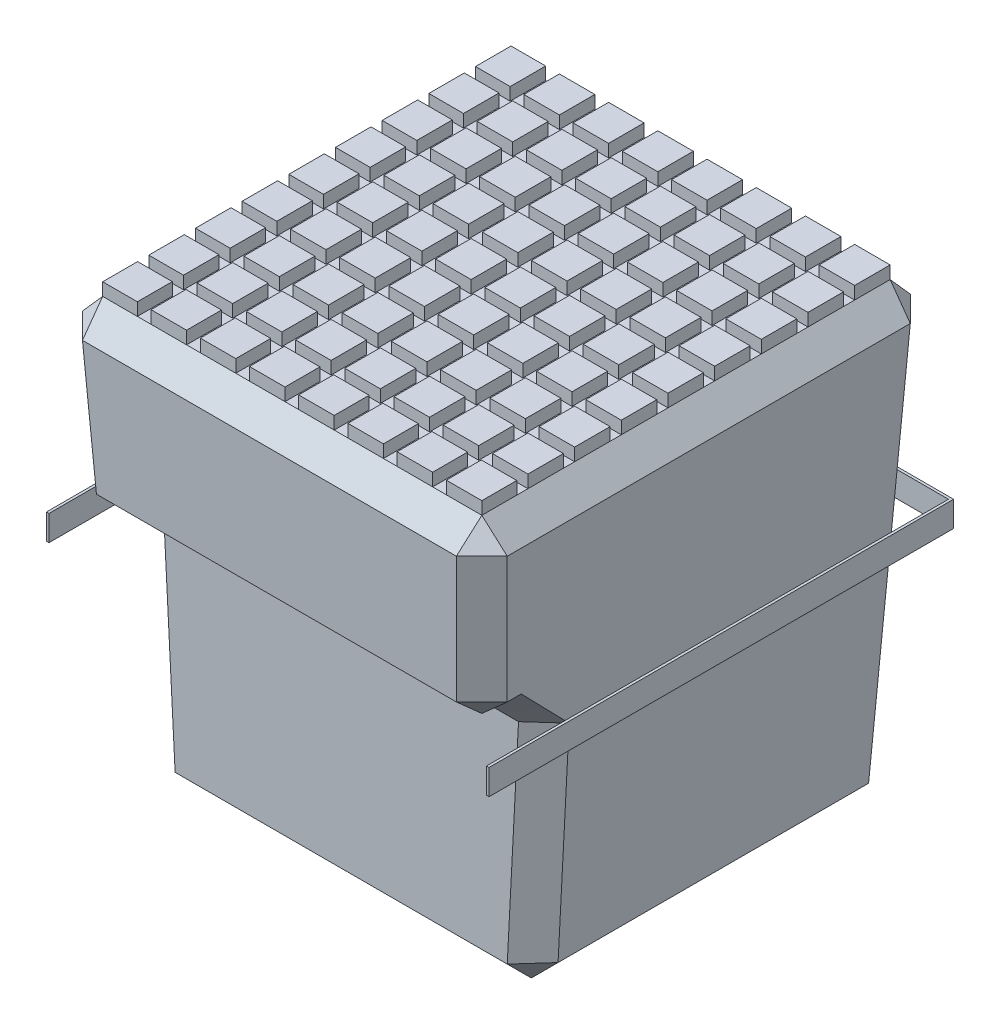
from build123d import *
from OCP.BRepFilletAPI import BRepFilletAPI_MakeChamfer

# Parameters (mm, degrees)
SKETCH2_W                = 337
SKETCH2_H                = 360
BOSS_EXTRUDE1_DEPTH      = 355
BOSS_EXTRUDE1_DRAFT      = -3
CUT_EXTRUDE1_DEPTH       = 433.223611109
CUT_EXTRUDE1_DEPTH_BACK  = 433.223611109
CHAMFER1_SIZE            = 20
CHAMFER1_SIZE2           = 21.135090055
CHAMFER1_SIZE2_2         = 20.055006944
CHAMFER1_SIZE2_3         = 19.030120562
SKETCH5_W                = 27.339758876
SKETCH5_H                = 28
SKETCH5_W_2              = 28
SKETCH5_H_2              = 27.539758876
BOSS_EXTRUDE2_DEPTH      = 10
BOSS_EXTRUDE3_DEPTH      = 10
BOSS_EXTRUDE3_DEPTH_BACK = 10


with BuildPart() as part:
    # Sketch2 → Boss-Extrude1 (with draft: the straight prism first)
    with BuildSketch(Plane(origin=(0, 0, 0), x_dir=(1, 0, 0), z_dir=(0, 1, 0))):
        Rectangle(SKETCH2_W, SKETCH2_H)
    extrude(amount=-BOSS_EXTRUDE1_DEPTH)
    # Boss-Extrude1: the draft: its side faces are tilted about the plane it starts from
    boss_extrude1_sides = [part.faces().sort_by_distance(p)[0] for p in [
        (0, -177.5, -180),
        (-168.5, -177.5, 0),
        (0, -177.5, 180),
        (168.5, -177.5, 0),
    ]]
    draft(boss_extrude1_sides, Plane(origin=(0, 0, 0), x_dir=(1, 0, 0), z_dir=(0, 1, 0)), BOSS_EXTRUDE1_DRAFT)

    # Sketch4 → Cut-Extrude1 (cut, two sides: drawn at the far end of the back side and taken through both)
    with BuildSketch(Plane(origin=(0, 0, 0), x_dir=(0, 0, -1), z_dir=(1, 0, 0)).offset(-CUT_EXTRUDE1_DEPTH_BACK)):
        Polygon((-172.400872004, -145), (-122.400872004, -145), (-122.400872004, -355), (-170.697619177, -355), align=None)
    extrude(amount=CUT_EXTRUDE1_DEPTH + CUT_EXTRUDE1_DEPTH_BACK, mode=Mode.SUBTRACT)

    # Chamfer1: one chamfer whose edges measure the first distance from different faces: ONE call of the kernel's chamfer builder (chamfer() names one face for all edges)
    chamfer1_edges_1 = [part.edges().sort_by_distance(p)[0] for p in [
        (149.895238355, -355, -19.497183175),
        (0, -355, -161.395238355),
        (-149.895238355, -355, -19.497183175),
    ]]
    chamfer1_side_1 = [part.faces().sort_by_distance(p)[0] for p in [
        (0, -355, -19.497183175),
    ]]
    chamfer1_edges_2 = [part.edges().sort_by_distance(p)[0] for p in [
        (0, -355, 122.400872004),
        (-155.398055179, -250, 122.400872004),
        (155.398055179, -250, 122.400872004),
        (0, -145, 122.400872004),
    ]]
    chamfer1_edges_3 = [part.edges().sort_by_distance(p)[0] for p in [
        (-164.700436002, -72.5, 176.200436002),
    ]]
    chamfer1_side_3 = [part.faces().sort_by_distance(p)[0] for p in [
        (0, -71.942486014, 176.229654072),
    ]]
    chamfer1_edges_4 = [part.edges().sort_by_distance(p)[0] for p in [
        (164.700436002, -72.5, 176.200436002),
    ]]
    chamfer1_side_4 = [part.faces().sort_by_distance(p)[0] for p in [
        (159.679195898, -168.310968763, -12.093988454),
    ]]
    chamfer1_edges_5 = [part.edges().sort_by_distance(p)[0] for p in [
        (0, -145, 172.400872004),
    ]]
    chamfer1_side_5 = [part.faces().sort_by_distance(p)[0] for p in [
        (0, -71.942486014, 176.229654072),
    ]]
    chamfer1_edges_6 = [part.edges().sort_by_distance(p)[0] for p in [
        (-160.900872004, -145, 147.400872004),
    ]]
    chamfer1_side_6 = [part.faces().sort_by_distance(p)[0] for p in [
        (-159.679195898, -168.310968763, -12.093988454),
    ]]
    chamfer1_edges_7 = [part.edges().sort_by_distance(p)[0] for p in [
        (160.900872004, -145, 147.400872004),
    ]]
    chamfer1_side_7 = [part.faces().sort_by_distance(p)[0] for p in [
        (159.679195898, -168.310968763, -12.093988454),
    ]]
    chamfer1_edges_8 = [part.edges().sort_by_distance(p)[0] for p in [
        (0, 0, -180),
    ]]
    chamfer1_side_8 = [part.faces().sort_by_distance(p)[0] for p in [
        (0, -174.042719243, -170.878807584),
    ]]
    chamfer1_edges_9 = [part.edges().sort_by_distance(p)[0] for p in [
        (168.5, 0, 0),
    ]]
    chamfer1_side_9 = [part.faces().sort_by_distance(p)[0] for p in [
        (159.679195898, -168.310968763, -12.093988454),
    ]]
    chamfer1_edges_10 = [part.edges().sort_by_distance(p)[0] for p in [
        (0, 0, 180),
    ]]
    chamfer1_side_10 = [part.faces().sort_by_distance(p)[0] for p in [
        (0, -71.942486014, 176.229654072),
    ]]
    chamfer1_edges_11 = [part.edges().sort_by_distance(p)[0] for p in [
        (-168.5, 0, 0),
    ]]
    chamfer1_side_11 = [part.faces().sort_by_distance(p)[0] for p in [
        (-159.679195898, -168.310968763, -12.093988454),
    ]]
    chamfer1_edges_12 = [part.edges().sort_by_distance(p)[0] for p in [
        (-159.197619177, -177.5, -170.697619177),
    ]]
    chamfer1_side_12 = [part.faces().sort_by_distance(p)[0] for p in [
        (-159.679195898, -168.310968763, -12.093988454),
    ]]
    chamfer1_edges_13 = [part.edges().sort_by_distance(p)[0] for p in [
        (159.197619177, -177.5, -170.697619177),
    ]]
    chamfer1_side_13 = [part.faces().sort_by_distance(p)[0] for p in [
        (0, -174.042719243, -170.878807584),
    ]]
    chamfer1 = BRepFilletAPI_MakeChamfer(part.part.solid().wrapped)
    for e in chamfer1_edges_1:
        chamfer1.Add(CHAMFER1_SIZE, CHAMFER1_SIZE2, e.wrapped, chamfer1_side_1[0].wrapped)  # the first distance lies on this face
    for e in chamfer1_edges_2:
        chamfer1.Add(CHAMFER1_SIZE, e.wrapped)
    for e in chamfer1_edges_3:
        chamfer1.Add(CHAMFER1_SIZE, CHAMFER1_SIZE2_2, e.wrapped, chamfer1_side_3[0].wrapped)  # the first distance lies on this face
    for e in chamfer1_edges_4:
        chamfer1.Add(CHAMFER1_SIZE, CHAMFER1_SIZE2_2, e.wrapped, chamfer1_side_4[0].wrapped)  # the first distance lies on this face
    for e in chamfer1_edges_5:
        chamfer1.Add(CHAMFER1_SIZE, CHAMFER1_SIZE2, e.wrapped, chamfer1_side_5[0].wrapped)  # the first distance lies on this face
    for e in chamfer1_edges_6:
        chamfer1.Add(CHAMFER1_SIZE, CHAMFER1_SIZE2, e.wrapped, chamfer1_side_6[0].wrapped)  # the first distance lies on this face
    for e in chamfer1_edges_7:
        chamfer1.Add(CHAMFER1_SIZE, CHAMFER1_SIZE2, e.wrapped, chamfer1_side_7[0].wrapped)  # the first distance lies on this face
    for e in chamfer1_edges_8:
        chamfer1.Add(CHAMFER1_SIZE, CHAMFER1_SIZE2_3, e.wrapped, chamfer1_side_8[0].wrapped)  # the first distance lies on this face
    for e in chamfer1_edges_9:
        chamfer1.Add(CHAMFER1_SIZE, CHAMFER1_SIZE2_3, e.wrapped, chamfer1_side_9[0].wrapped)  # the first distance lies on this face
    for e in chamfer1_edges_10:
        chamfer1.Add(CHAMFER1_SIZE, CHAMFER1_SIZE2_3, e.wrapped, chamfer1_side_10[0].wrapped)  # the first distance lies on this face
    for e in chamfer1_edges_11:
        chamfer1.Add(CHAMFER1_SIZE, CHAMFER1_SIZE2_3, e.wrapped, chamfer1_side_11[0].wrapped)  # the first distance lies on this face
    for e in chamfer1_edges_12:
        chamfer1.Add(CHAMFER1_SIZE, CHAMFER1_SIZE2_2, e.wrapped, chamfer1_side_12[0].wrapped)  # the first distance lies on this face
    for e in chamfer1_edges_13:
        chamfer1.Add(CHAMFER1_SIZE, CHAMFER1_SIZE2_2, e.wrapped, chamfer1_side_13[0].wrapped)  # the first distance lies on this face
    add(Compound.cast(chamfer1.Shape()), mode=Mode.REPLACE)

    # Sketch5 → Boss-Extrude2 (add)
    with BuildSketch(Plane(origin=(0, 0, 0), x_dir=(1, 0, 0), z_dir=(0, 1, 0))):
        with Locations((-135.8, 146.969879438)):
            Rectangle(SKETCH5_W, SKETCH5_H)
        with Locations((-97.330120562, 146.969879438)):
            Rectangle(SKETCH5_W_2, SKETCH5_H)
        with Locations((-58.530120562, 146.969879438)):
            Rectangle(SKETCH5_W_2, SKETCH5_H)
        with Locations((19.069879438, 146.969879438)):
            Rectangle(SKETCH5_W_2, SKETCH5_H)
        with Locations((57.869879438, 146.969879438)):
            Rectangle(SKETCH5_W_2, SKETCH5_H)
        with Locations((96.669879438, 146.969879438)):
            Rectangle(SKETCH5_W_2, SKETCH5_H)
        with Locations((135.469879438, 146.969879438)):
            Rectangle(SKETCH5_W_2, SKETCH5_H)
        with Locations((135.469879438, 110.169879438)):
            Rectangle(SKETCH5_W_2, SKETCH5_H)
        with Locations((57.869879438, 110.169879438)):
            Rectangle(SKETCH5_W_2, SKETCH5_H)
        with Locations((19.069879438, 110.169879438)):
            Rectangle(SKETCH5_W_2, SKETCH5_H)
        with Locations((-19.730120562, 110.169879438)):
            Rectangle(SKETCH5_W_2, SKETCH5_H)
        with Locations((-58.530120562, 110.169879438)):
            Rectangle(SKETCH5_W_2, SKETCH5_H)
        with Locations((-97.330120562, 110.169879438)):
            Rectangle(SKETCH5_W_2, SKETCH5_H)
        with Locations((-135.8, 110.169879438)):
            Rectangle(SKETCH5_W, SKETCH5_H)
        with Locations((-135.8, 73.369879438)):
            Rectangle(SKETCH5_W, SKETCH5_H)
        with Locations((-97.330120562, 73.369879438)):
            Rectangle(SKETCH5_W_2, SKETCH5_H)
        with Locations((-58.530120562, 73.369879438)):
            Rectangle(SKETCH5_W_2, SKETCH5_H)
        with Locations((-19.730120562, 73.369879438)):
            Rectangle(SKETCH5_W_2, SKETCH5_H)
        with Locations((19.069879438, 73.369879438)):
            Rectangle(SKETCH5_W_2, SKETCH5_H)
        with Locations((57.869879438, 73.369879438)):
            Rectangle(SKETCH5_W_2, SKETCH5_H)
        with Locations((96.669879438, 73.369879438)):
            Rectangle(SKETCH5_W_2, SKETCH5_H)
        with Locations((96.669879438, 36.569879438)):
            Rectangle(SKETCH5_W_2, SKETCH5_H)
        with Locations((57.869879438, 36.569879438)):
            Rectangle(SKETCH5_W_2, SKETCH5_H)
        with Locations((19.069879438, 36.569879438)):
            Rectangle(SKETCH5_W_2, SKETCH5_H)
        with Locations((-19.730120562, 36.569879438)):
            Rectangle(SKETCH5_W_2, SKETCH5_H)
        with Locations((-97.330120562, 36.569879438)):
            Rectangle(SKETCH5_W_2, SKETCH5_H)
        with Locations((-135.8, 36.569879438)):
            Rectangle(SKETCH5_W, SKETCH5_H)
        with Locations((-58.530120562, 36.569879438)):
            Rectangle(SKETCH5_W_2, SKETCH5_H)
        with Locations((-97.330120562, -0.230120562)):
            Rectangle(SKETCH5_W_2, SKETCH5_H)
        with Locations((-135.8, -0.230120562)):
            Rectangle(SKETCH5_W, SKETCH5_H)
        with Locations((-135.8, -37.030120562)):
            Rectangle(SKETCH5_W, SKETCH5_H)
        with Locations((-97.330120562, -37.030120562)):
            Rectangle(SKETCH5_W_2, SKETCH5_H)
        with Locations((-58.530120562, -37.030120562)):
            Rectangle(SKETCH5_W_2, SKETCH5_H)
        with Locations((-19.730120562, -37.030120562)):
            Rectangle(SKETCH5_W_2, SKETCH5_H)
        with Locations((19.069879438, -0.230120562)):
            Rectangle(SKETCH5_W_2, SKETCH5_H)
        with Locations((57.869879438, -37.030120562)):
            Rectangle(SKETCH5_W_2, SKETCH5_H)
        with Locations((57.869879438, -0.230120562)):
            Rectangle(SKETCH5_W_2, SKETCH5_H)
        with Locations((96.669879438, -0.230120562)):
            Rectangle(SKETCH5_W_2, SKETCH5_H)
        with Locations((96.669879438, -37.030120562)):
            Rectangle(SKETCH5_W_2, SKETCH5_H)
        with Locations((135.469879438, -37.030120562)):
            Rectangle(SKETCH5_W_2, SKETCH5_H)
        with Locations((135.469879438, -0.230120562)):
            Rectangle(SKETCH5_W_2, SKETCH5_H)
        with Locations((135.469879438, -73.830120562)):
            Rectangle(SKETCH5_W_2, SKETCH5_H)
        with Locations((96.669879438, -110.630120562)):
            Rectangle(SKETCH5_W_2, SKETCH5_H)
        with Locations((135.469879438, -110.630120562)):
            Rectangle(SKETCH5_W_2, SKETCH5_H)
        with Locations((135.469879438, -147.2)):
            Rectangle(SKETCH5_W_2, SKETCH5_H_2)
        with Locations((96.669879438, -147.2)):
            Rectangle(SKETCH5_W_2, SKETCH5_H_2)
        with Locations((57.869879438, -147.2)):
            Rectangle(SKETCH5_W_2, SKETCH5_H_2)
        with Locations((57.869879438, -110.630120562)):
            Rectangle(SKETCH5_W_2, SKETCH5_H)
        with Locations((19.069879438, -73.830120562)):
            Rectangle(SKETCH5_W_2, SKETCH5_H)
        with Locations((19.069879438, -110.630120562)):
            Rectangle(SKETCH5_W_2, SKETCH5_H)
        with Locations((19.069879438, -147.2)):
            Rectangle(SKETCH5_W_2, SKETCH5_H_2)
        with Locations((-19.730120562, -147.2)):
            Rectangle(SKETCH5_W_2, SKETCH5_H_2)
        with Locations((-19.730120562, -110.630120562)):
            Rectangle(SKETCH5_W_2, SKETCH5_H)
        with Locations((-19.730120562, -73.830120562)):
            Rectangle(SKETCH5_W_2, SKETCH5_H)
        with Locations((-58.530120562, -73.830120562)):
            Rectangle(SKETCH5_W_2, SKETCH5_H)
        with Locations((-58.530120562, -110.630120562)):
            Rectangle(SKETCH5_W_2, SKETCH5_H)
        with Locations((-58.530120562, -147.2)):
            Rectangle(SKETCH5_W_2, SKETCH5_H_2)
        with Locations((57.869879438, -73.830120562)):
            Rectangle(SKETCH5_W_2, SKETCH5_H)
        with Locations((96.669879438, -73.830120562)):
            Rectangle(SKETCH5_W_2, SKETCH5_H)
        with Locations((-97.330120562, -110.630120562)):
            Rectangle(SKETCH5_W_2, SKETCH5_H)
        with Locations((-97.330120562, -73.830120562)):
            Rectangle(SKETCH5_W_2, SKETCH5_H)
        with Locations((-135.8, -73.830120562)):
            Rectangle(SKETCH5_W, SKETCH5_H)
        with Locations((-135.8, -110.630120562)):
            Rectangle(SKETCH5_W, SKETCH5_H)
        with Locations((-135.8, -147.2)):
            Rectangle(SKETCH5_W, SKETCH5_H_2)
        with Locations((-97.330120562, -147.2)):
            Rectangle(SKETCH5_W_2, SKETCH5_H_2)
        with Locations((-19.730120562, 146.969879438)):
            Rectangle(SKETCH5_W_2, SKETCH5_H)
        with Locations((96.669879438, 110.169879438)):
            Rectangle(SKETCH5_W_2, SKETCH5_H)
        with Locations((135.469879438, 73.369879438)):
            Rectangle(SKETCH5_W_2, SKETCH5_H)
        with Locations((135.469879438, 36.569879438)):
            Rectangle(SKETCH5_W_2, SKETCH5_H)
        with Locations((-58.530120562, -0.230120562)):
            Rectangle(SKETCH5_W_2, SKETCH5_H)
        with Locations((-19.730120562, -0.230120562)):
            Rectangle(SKETCH5_W_2, SKETCH5_H)
        with Locations((19.069879438, -37.030120562)):
            Rectangle(SKETCH5_W_2, SKETCH5_H)
    extrude(amount=BOSS_EXTRUDE2_DEPTH)


with BuildPart() as body_2:
    # Sketch7 → Boss-Extrude3 (new, two sides: drawn at the far end of the back side and taken through both)
    with BuildSketch(Plane(origin=(0, -160, 0), x_dir=(1, 0, 0), z_dir=(0, 1, 0)).offset(-BOSS_EXTRUDE3_DEPTH_BACK)):
        Polygon((174.453280875, 174.703753628), (174.453280875, -15.242609377), (174.453280875, -180.311797845), (172.453280875, -180.311797845), (172.453280875, -15.242609377), (172.453280875, 183.953280875), (-172.453280875, 183.953280875), (-172.453280875, -15.242609377), (-172.453280875, -180.311797845), (-174.453280875, -180.311797845), (-174.453280875, -15.242609377), (-174.453280875, 185.953280875), (174.453280875, 185.953280875), align=None)
    extrude(amount=BOSS_EXTRUDE3_DEPTH + BOSS_EXTRUDE3_DEPTH_BACK)


solid = Compound([part.part, body_2.part])
